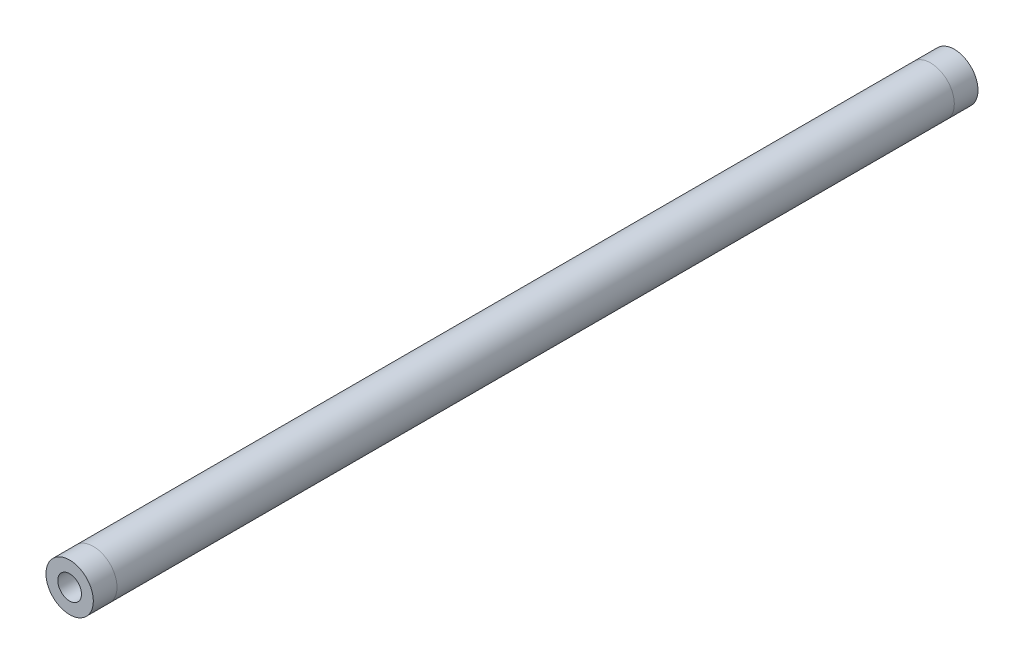
from build123d import *

# Parameters (mm, degrees)
SKETCH1_R                 = 6.35
SKETCH1_R_2               = 4.8768
SKETCH1_R_3               = 3.175
THREADED_INSERT_1_1_DEPTH = 6.35
THREADED_START            = -6.35
SKETCH1_3_R               = 4.8768
SKETCH1_3_R_2             = 3.175
THREADED_INSERT_1_2_DEPTH = 9.525
TUBE_START                = -6.35
SKETCH1_4_R               = 6.35
SKETCH1_4_R_2             = 4.8768
TUBE_EXTRUDE_DEPTH        = 224.505622
THREADED_START_2          = -230.855622
SKETCH1_6_R               = 4.8768
SKETCH1_6_R_2             = 3.175
THREADED_INSERT_2_1_DEPTH = 9.525
SKETCH1_9_R               = 6.35
SKETCH1_9_R_2             = 4.8768
SKETCH1_9_R_3             = 3.175
THREADED_INSERT_2_2_DEPTH = 6.35


with BuildPart() as part:
    # Sketch1 → Threaded insert 1-1 (new body)
    # profile 1 of 2: a face of its own
    with BuildSketch(Plane.XY):
        Circle(SKETCH1_R)
        Circle(SKETCH1_R_2, mode=Mode.SUBTRACT)
    # profile 2 of 2: a face of its own
    with BuildSketch(Plane.XY):
        Circle(SKETCH1_R_2)
        Circle(SKETCH1_R_3, mode=Mode.SUBTRACT)
    extrude(amount=-THREADED_INSERT_1_1_DEPTH)

    # Sketch1<3> → Threaded insert 1-2 (add)
    with BuildSketch(Plane.XY.offset(THREADED_START)):
        Circle(SKETCH1_3_R)
        Circle(SKETCH1_3_R_2, mode=Mode.SUBTRACT)
    extrude(amount=-THREADED_INSERT_1_2_DEPTH)


with BuildPart() as body_2:
    # Sketch1<4> → Tube extrude (new body)
    with BuildSketch(Plane.XY.offset(TUBE_START)):
        Circle(SKETCH1_4_R)
        Circle(SKETCH1_4_R_2, mode=Mode.SUBTRACT)
    extrude(amount=-TUBE_EXTRUDE_DEPTH)


with BuildPart() as body_3:
    # Sketch1<6> → Threaded insert 2-1 (new body)
    with BuildSketch(Plane.XY.offset(THREADED_START_2)):
        Circle(SKETCH1_6_R)
        Circle(SKETCH1_6_R_2, mode=Mode.SUBTRACT)
    extrude(amount=THREADED_INSERT_2_1_DEPTH)


with BuildPart() as body_4:
    # Sketch1<9> → Threaded insert 2-2 (new body)
    # profile 1 of 2: a face of its own
    with BuildSketch(Plane.XY.offset(THREADED_START_2)):
        Circle(SKETCH1_9_R)
        Circle(SKETCH1_9_R_2, mode=Mode.SUBTRACT)
    # profile 2 of 2: a face of its own
    with BuildSketch(Plane.XY.offset(THREADED_START_2)):
        Circle(SKETCH1_9_R_2)
        Circle(SKETCH1_9_R_3, mode=Mode.SUBTRACT)
    extrude(amount=-THREADED_INSERT_2_2_DEPTH)

    # Combine1: union body 3
    add(body_3.part)


solid = Compound([part.part, body_2.part, body_4.part])
